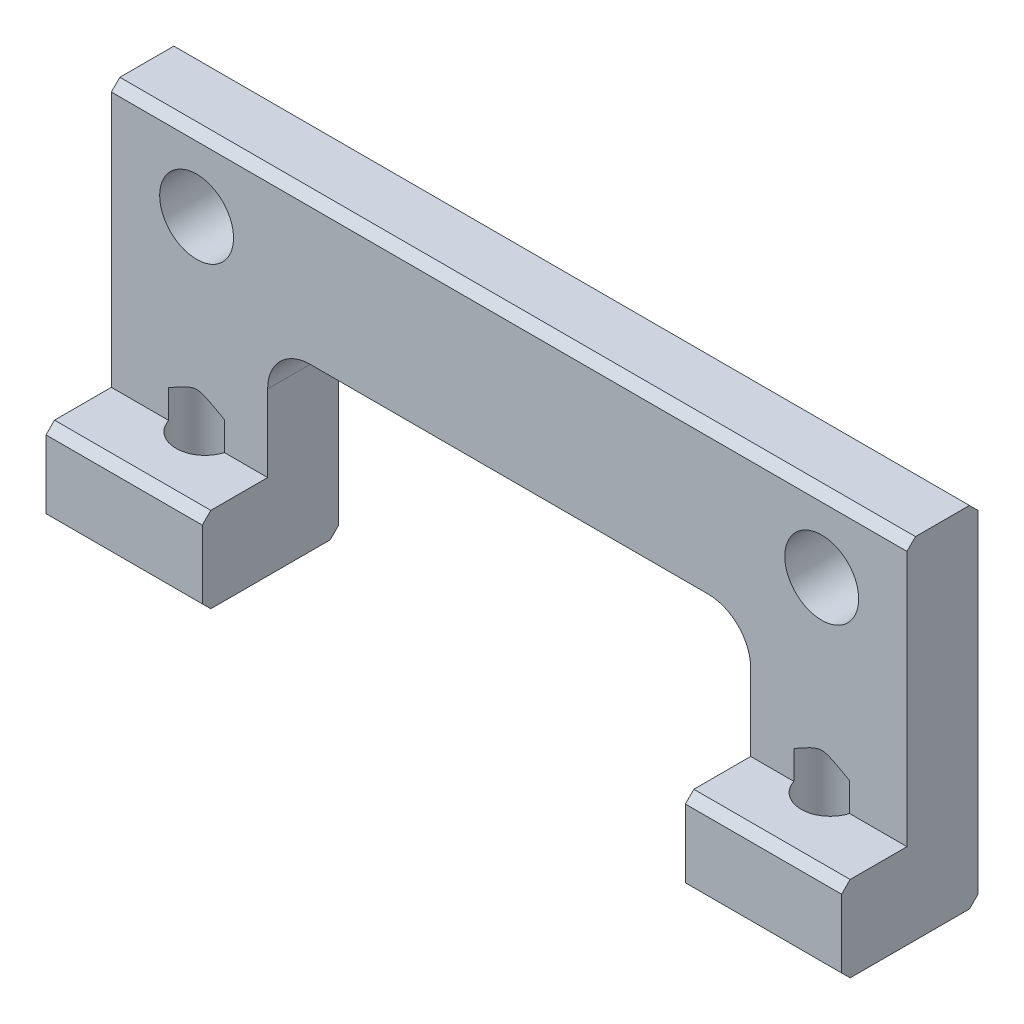
from build123d import *

# Parameters (mm, degrees)
SKETCH1_W                        = 5.5
SKETCH1_H                        = 12.3
BOSS_EXTRUDE1_DEPTH              = 4.8
SKETCH2_W                        = 2.3
SKETCH2_H                        = 9.3
CUT_EXTRUDE1_DEPTH               = 14.703649149
SKETCH3_W                        = 2.5
SKETCH3_H                        = 5.1
BOSS_EXTRUDE2_DEPTH              = 22.5
SKETCH4_W                        = 5.5
SKETCH4_H                        = 2.5
BOSS_EXTRUDE3_DEPTH              = 7.2
SKETCH5_W                        = 5.5
SKETCH5_H                        = 3
BOSS_EXTRUDE4_DEPTH              = 2.3
F_2_6_2_6_DIAMETER_HOLE1_D       = 2.6
F_2_6_2_6_DIAMETER_HOLE1_DEPTH   = 4.8
F_2_05_2_05_DIAMETER_HOLE1_D     = 2.05
F_2_05_2_05_DIAMETER_HOLE1_DEPTH = 4
F_2_05_2_05_DIAMETER_HOLE1_TIP   = 0.615882135
CHAMFER1_SIZE                    = 0.3
CHAMFER2_SIZE                    = 0.2
FILLET1_R                        = 1.5


with BuildPart() as part:
    # Sketch1 → Boss-Extrude1 (new body)
    with BuildSketch(Plane(origin=(0, 0, -2.5), x_dir=(-1, 0, 0), z_dir=(0, 0, -1))):
        with Locations((-11.25, 6.15)):
            Rectangle(SKETCH1_W, SKETCH1_H)
    extrude(amount=-BOSS_EXTRUDE1_DEPTH)

    # Sketch2 → Cut-Extrude1 (cut, through all)
    with BuildSketch(Plane.ZY.offset(-8.5)):
        with Locations((1.15, 7.65)):
            Rectangle(SKETCH2_W, SKETCH2_H)
    extrude(amount=-CUT_EXTRUDE1_DEPTH, mode=Mode.SUBTRACT)

    # Sketch3 → Boss-Extrude2 (add)
    with BuildSketch(Plane.ZY.offset(-8.5)):
        with Locations((-1.25, 9.75)):
            Rectangle(SKETCH3_W, SKETCH3_H)
    extrude(amount=BOSS_EXTRUDE2_DEPTH)

    # Sketch4 → Boss-Extrude3 (add)
    with BuildSketch(Plane.XZ.offset(-7.2)):
        with Locations((-11.25, -1.25)):
            Rectangle(SKETCH4_W, SKETCH4_H)
    extrude(amount=BOSS_EXTRUDE3_DEPTH)

    # Sketch5 → Boss-Extrude4 (add)
    with BuildSketch(Plane.XY):
        with Locations((-11.25, 1.5)):
            Rectangle(SKETCH5_W, SKETCH5_H)
    extrude(amount=BOSS_EXTRUDE4_DEPTH)

    # Ø2.6 (2.6) Diameter Hole1
    with Locations(Plane(origin=(0, 0, -2.5), x_dir=(-1, 0, 0), z_dir=(0, 0, -1))):
        with Locations((11, 9.7), (-11, 9.7)):
            Hole(F_2_6_2_6_DIAMETER_HOLE1_D / 2, depth=F_2_6_2_6_DIAMETER_HOLE1_DEPTH)

    # Ø2.05 (2.05) Diameter Hole1
    with Locations(Plane(origin=(0, 0, 0), x_dir=(-1, 0, 0), z_dir=(0, -1, 0))):
        with Locations((-11, 0.3), (11, 0.3)):
            Hole(F_2_05_2_05_DIAMETER_HOLE1_D / 2, depth=F_2_05_2_05_DIAMETER_HOLE1_DEPTH)
            with Locations((0, 0, -(F_2_05_2_05_DIAMETER_HOLE1_DEPTH + F_2_05_2_05_DIAMETER_HOLE1_TIP / 2))):  # 118° drill point
                Cone(0, F_2_05_2_05_DIAMETER_HOLE1_D / 2, F_2_05_2_05_DIAMETER_HOLE1_TIP, mode=Mode.SUBTRACT)

    # Chamfer1
    chamfer1_edges = [part.edges().sort_by_distance(p)[0] for p in [
        (11.25, 3, 2.3),
        (0, 12.3, 0),
        (11.25, 0, 2.3),
        (-11.25, 0, -2.5),
        (0, 12.3, -2.5),
        (-11.25, 0, 2.3),
        (11.25, 0, -2.5),
        (-11.25, 3, 2.3),
        (9.7, 9.7, -2.5),
        (-12.025, 0, -0.3),
        (9.975, 0, -0.3),
    ]]
    chamfer(chamfer1_edges, length=CHAMFER1_SIZE)

    # Chamfer2
    chamfer2_edges = [part.edges().sort_by_distance(p)[0] for p in [
        (-12.3, 9.7, -2.5),
    ]]
    chamfer(chamfer2_edges, length=CHAMFER2_SIZE)

    # Fillet1
    fillet1_edges = [part.edges().sort_by_distance(p)[0] for p in [
        (8.5, 7.2, -1.25),
        (-8.5, 7.2, -1.25),
    ]]
    fillet(fillet1_edges, radius=FILLET1_R)


solid = part.part
